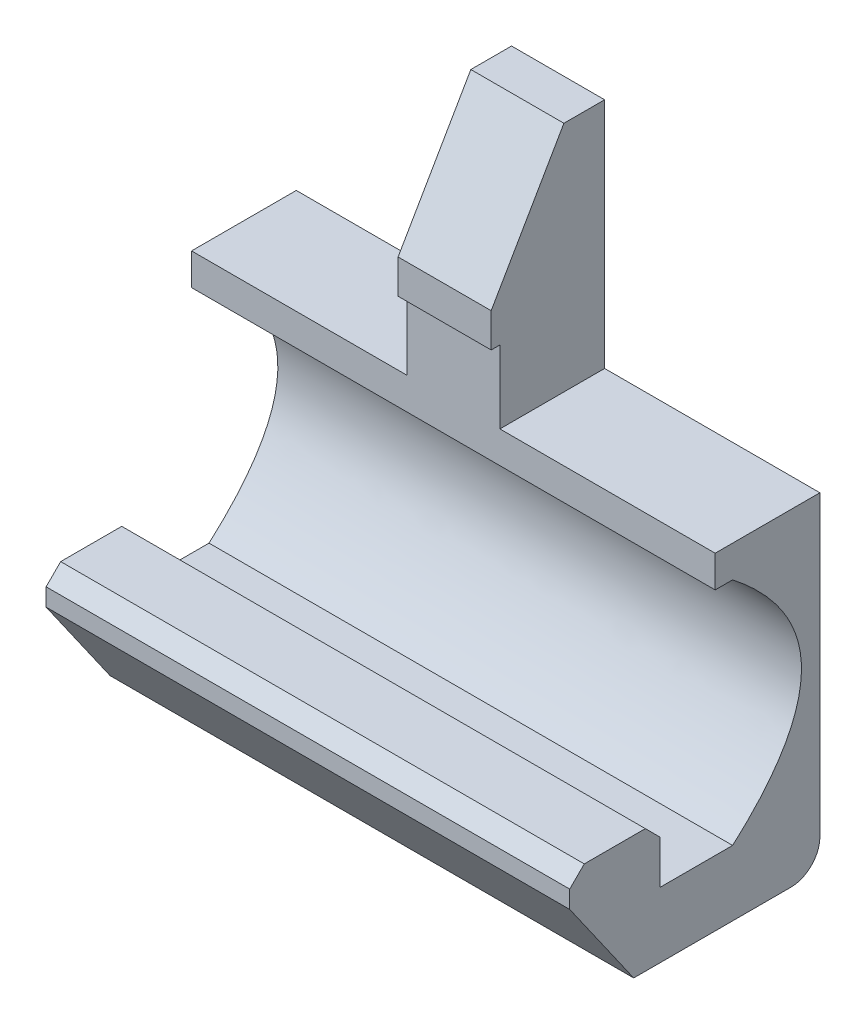
from build123d import *

# Parameters (mm, degrees)
SKETCH1_W           = 5
SKETCH1_H           = 5
BOSS_EXTRUDE1_DEPTH = 2
SKETCH2_W           = 3.2
SKETCH2_H           = 3
BOSS_EXTRUDE2_DEPTH = 5
SKETCH3_W           = 3.2
SKETCH3_H           = 3.6
BOSS_EXTRUDE3_DEPTH = 3
CUT_EXTRUDE1_DEPTH  = 12.093241186
SKETCH6_W           = 5
SKETCH6_H           = 2
CUT_EXTRUDE2_DEPTH  = 12.456439237
SKETCH7_W           = 18
SKETCH7_H           = 4
BOSS_EXTRUDE5_DEPTH = 13
SKETCH8_W           = 18
SKETCH8_H           = 6
BOSS_EXTRUDE6_DEPTH = 4
SKETCH9_W           = 1.5
SKETCH9_H           = 2
CUT_EXTRUDE4_DEPTH  = 22.800229357
SKETCH10_W          = 1
SKETCH10_H          = 9
CUT_EXTRUDE5_DEPTH  = 22.800229357
CUT_EXTRUDE6_DEPTH  = 22.800229357
BOSS_EXTRUDE7_DEPTH = 0.6
SKETCH13_W          = 3.9
SKETCH13_H          = 5.5
BOSS_EXTRUDE8_DEPTH = 3.2
CHAMFER2_SIZE       = 2.5
CHAMFER2_SIZE2      = 4.330127019
SKETCH14_W          = 8
SKETCH14_H          = 1.75299242
CUT_EXTRUDE7_DEPTH  = 22.800229515
SKETCH16_W          = 18
SKETCH16_H          = 4.24700758
BOSS_EXTRUDE9_DEPTH = 0.6
CHAMFER4_SIZE       = 2.2
CHAMFER4_SIZE2      = 3.141925615
CHAMFER5_SIZE       = 0.5
FILLET1_R           = 1


with BuildPart() as part:
    # Sketch1 → Boss-Extrude1 (new body)
    with BuildSketch(Plane(origin=(0, 0, 0), x_dir=(1, 0, 0), z_dir=(0, 1, 0))):
        Rectangle(SKETCH1_W, SKETCH1_H)
    extrude(amount=BOSS_EXTRUDE1_DEPTH)

    # Sketch2 → Boss-Extrude2 (add)
    with BuildSketch(Plane(origin=(0, 2, 0), x_dir=(1, 0, 0), z_dir=(0, 1, 0))):
        with Locations((0, 1)):
            Rectangle(SKETCH2_W, SKETCH2_H)
    extrude(amount=BOSS_EXTRUDE2_DEPTH)

    # Sketch3 → Boss-Extrude3 (add)
    with BuildSketch(Plane(origin=(0, 7, 0), x_dir=(1, 0, 0), z_dir=(0, 1, 0))):
        with Locations((0, 0.7)):
            Rectangle(SKETCH3_W, SKETCH3_H)
    extrude(amount=BOSS_EXTRUDE3_DEPTH)

    # Sketch4 → Cut-Extrude1 (cut, through all)
    with BuildSketch(Plane(origin=(1.6, 0, 0), x_dir=(0, 0, -1), z_dir=(1, 0, 0))):
        Polygon((-1.1, 7), (0.75, 10), (-1.1, 10), align=None)
    extrude(amount=-CUT_EXTRUDE1_DEPTH, mode=Mode.SUBTRACT)

    # Sketch6 → Cut-Extrude2 (cut, through all)
    with BuildSketch(Plane.XY.offset(2.5)):
        with Locations((0, 1)):
            Rectangle(SKETCH6_W, SKETCH6_H)
    extrude(amount=-CUT_EXTRUDE2_DEPTH, mode=Mode.SUBTRACT)

    # Sketch7 → Boss-Extrude5 (add)
    with BuildSketch(Plane.XZ.offset(-2)):
        with Locations((0, -0.5)):
            Rectangle(SKETCH7_W, SKETCH7_H)
    extrude(amount=BOSS_EXTRUDE5_DEPTH)

    # Sketch8 → Boss-Extrude6 (add)
    with BuildSketch(Plane.XY.offset(1.5)):
        with Locations((0, -8)):
            Rectangle(SKETCH8_W, SKETCH8_H)
    extrude(amount=BOSS_EXTRUDE6_DEPTH)

    # Sketch9 → Cut-Extrude4 (cut, through all)
    with BuildSketch(Plane(origin=(9, 0, 0), x_dir=(0, 0, -1), z_dir=(1, 0, 0))):
        with Locations((-2.25, -6)):
            Rectangle(SKETCH9_W, SKETCH9_H)
    extrude(amount=-CUT_EXTRUDE4_DEPTH, mode=Mode.SUBTRACT)

    # Sketch10 → Cut-Extrude5 (cut, through all)
    with BuildSketch(Plane(origin=(9, 0, 0), x_dir=(0, 0, -1), z_dir=(1, 0, 0))):
        with Locations((-1, -2.5)):
            Rectangle(SKETCH10_W, SKETCH10_H)
    extrude(amount=-CUT_EXTRUDE5_DEPTH, mode=Mode.SUBTRACT)

    # Sketch11 → Cut-Extrude6 (cut, through all)
    with BuildSketch(Plane(origin=(9, 0, 0), x_dir=(0, 0, -1), z_dir=(1, 0, 0))):
        with BuildLine():
            Line((-0.5, 0.906362555), (-0.5, -7))
            add(Edge.make_bspline(
                [(-0.5, 0.906362555), (4.232995097, -2.809658902), (-0.5, -7)],
                knots=[0, 0, 0, 1, 1, 1], degree=2))
        make_face()
    extrude(amount=-CUT_EXTRUDE6_DEPTH, mode=Mode.SUBTRACT)

    # Sketch12 → Boss-Extrude7 (add)
    with BuildSketch(Plane.XY.offset(0.5)):
        Polygon((-9, 2), (-9, 0.906362555), (9, 0.906362555), (9, 2), (1.6, 2), (1.6, 7), (-1.6, 7), (-1.6, 2), align=None)
    extrude(amount=BOSS_EXTRUDE7_DEPTH)

    # Sketch13 → Boss-Extrude8 (add)
    with BuildSketch(Plane.ZY.offset(1.6)):
        with Locations((-0.55, 7.25)):
            Rectangle(SKETCH13_W, SKETCH13_H)
    extrude(amount=-BOSS_EXTRUDE8_DEPTH)

    # Chamfer2
    chamfer2_edges = [part.edges().sort_by_distance(p)[0] for p in [
        (0, 10, 1.4),
    ]]
    chamfer2_side = [part.faces().sort_by_distance(p)[0] for p in [
        (0, 10, -0.55),
    ]]
    chamfer(chamfer2_edges, length=CHAMFER2_SIZE, length2=CHAMFER2_SIZE2, reference=chamfer2_side[0])

    # Sketch14 → Cut-Extrude7 (cut, through all)
    with BuildSketch(Plane(origin=(9, 0, 0), x_dir=(0, 0, -1), z_dir=(1, 0, 0))):
        with Locations((-1.5, -10.12350379)):
            Rectangle(SKETCH14_W, SKETCH14_H)
    extrude(amount=-CUT_EXTRUDE7_DEPTH, mode=Mode.SUBTRACT)

    # Sketch16 → Boss-Extrude9 (add)
    with BuildSketch(Plane.XY.offset(5.5)):
        with Locations((0, -7.12350379)):
            Rectangle(SKETCH16_W, SKETCH16_H)
    extrude(amount=BOSS_EXTRUDE9_DEPTH)

    # Chamfer4
    chamfer4_edges = [part.edges().sort_by_distance(p)[0] for p in [
        (0, -9.24700758, 6.1),
    ]]
    chamfer4_side = [part.faces().sort_by_distance(p)[0] for p in [
        (0, -9.24700758, 1.8),
    ]]
    chamfer(chamfer4_edges, length=CHAMFER4_SIZE, length2=CHAMFER4_SIZE2, reference=chamfer4_side[0])

    # Chamfer5
    chamfer5_edges = [part.edges().sort_by_distance(p)[0] for p in [
        (0, -5, 3),
        (0, -5, 6.1),
    ]]
    chamfer(chamfer5_edges, length=CHAMFER5_SIZE)

    # Fillet1
    fillet1_edges = [part.edges().sort_by_distance(p)[0] for p in [
        (0, -9.24700758, -2.5),
    ]]
    fillet(fillet1_edges, radius=FILLET1_R)


solid = part.part
